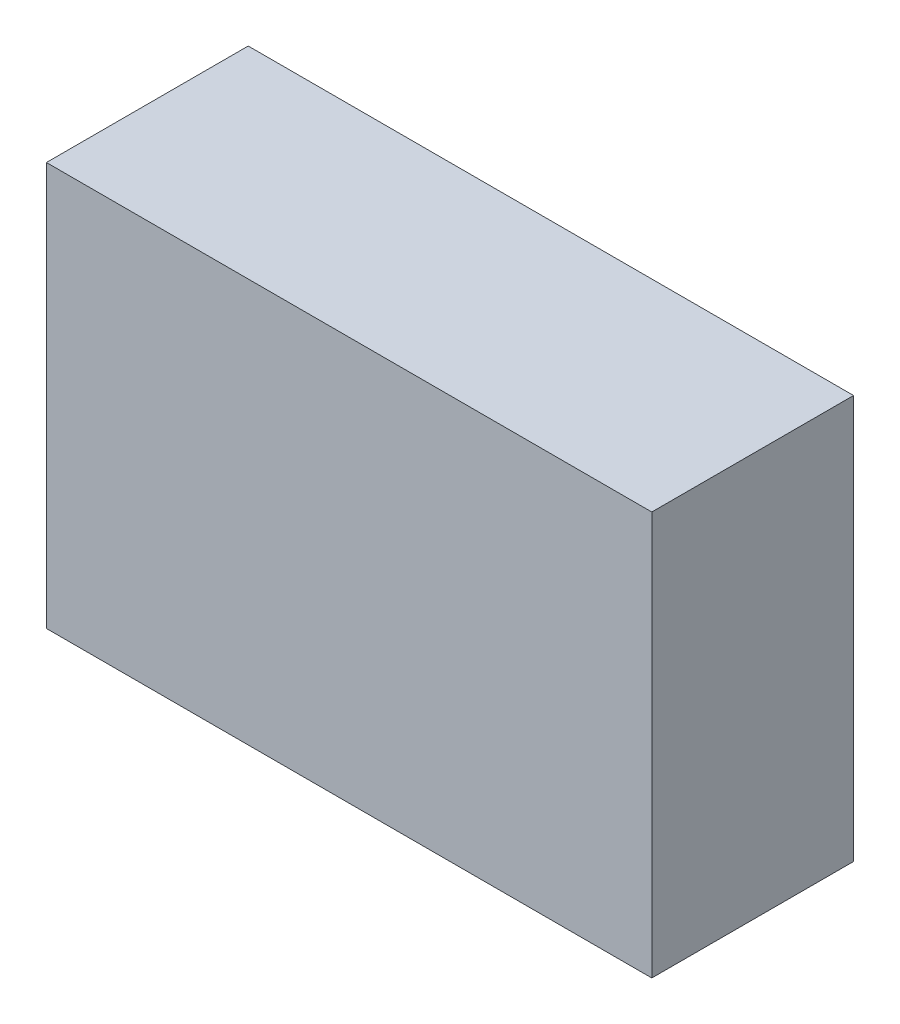
from build123d import *

# Parameters (mm, degrees)
CROQUIS1_W              = 1.5
CROQUIS1_H              = 1
SALIENTE_EXTRUIR1_DEPTH = 0.5


with BuildPart() as part:
    # Croquis1 → Saliente-Extruir1 (new body)
    with BuildSketch(Plane.XY):
        Rectangle(CROQUIS1_W, CROQUIS1_H)
    extrude(amount=SALIENTE_EXTRUIR1_DEPTH)


solid = part.part
